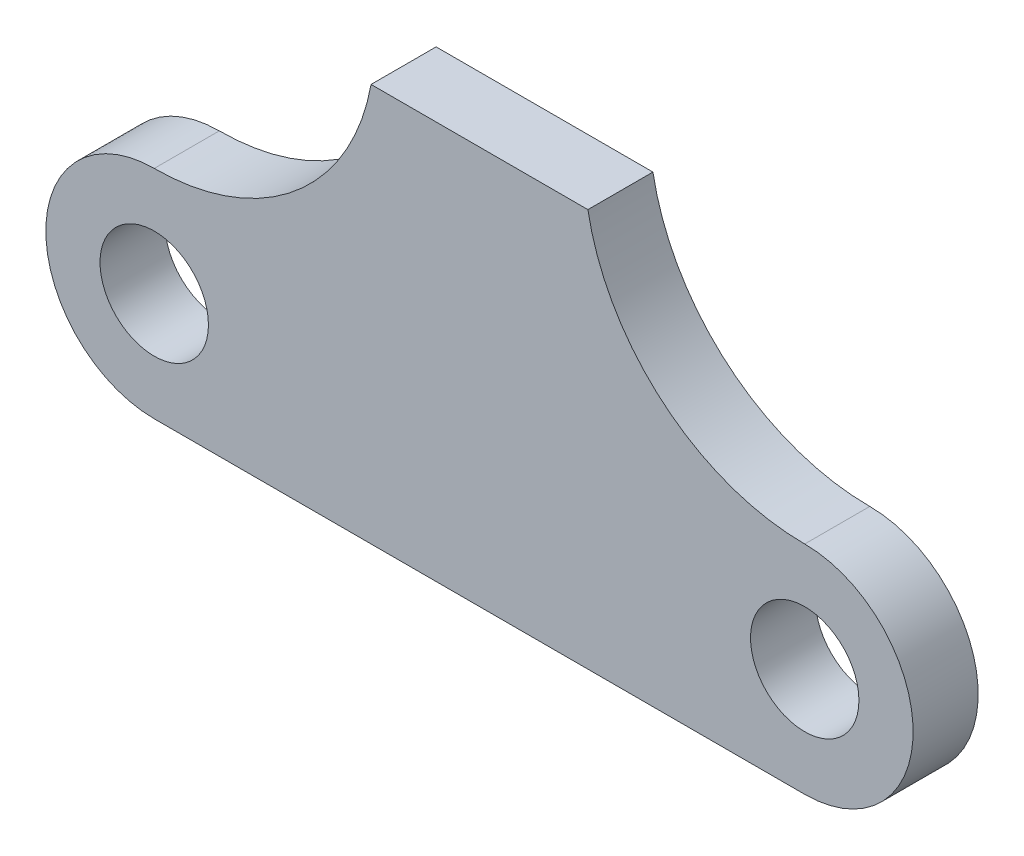
from build123d import *

# Parameters (mm, degrees)
SKETCH1_R           = 2.5
BOSS_EXTRUDE1_DEPTH = 3


with BuildPart() as part:
    # Sketch1 → Boss-Extrude1 (new body)
    with BuildSketch(Plane.XY):
        with BuildLine():
            Line((-15, -5), (15, -5))
            ThreePointArc((15, -5), (20, 0), (15, 5))
            ThreePointArc((15, 5), (8.484438885, 7.363719427), (4.9999991, 13.355245572))
            Line((4.9999991, 13.355245572), (-5.0000009, 13.35523561))
            ThreePointArc((-5.0000009, 13.35523561), (-8.48444277, 7.363716181), (-15, 5))
            ThreePointArc((-15, 5), (-20, 0), (-15, -5))
        make_face()
        with Locations((-15, 0)):
            Circle(SKETCH1_R, mode=Mode.SUBTRACT)
        with Locations((15, 0)):
            Circle(SKETCH1_R, mode=Mode.SUBTRACT)
    extrude(amount=BOSS_EXTRUDE1_DEPTH)


solid = part.part
